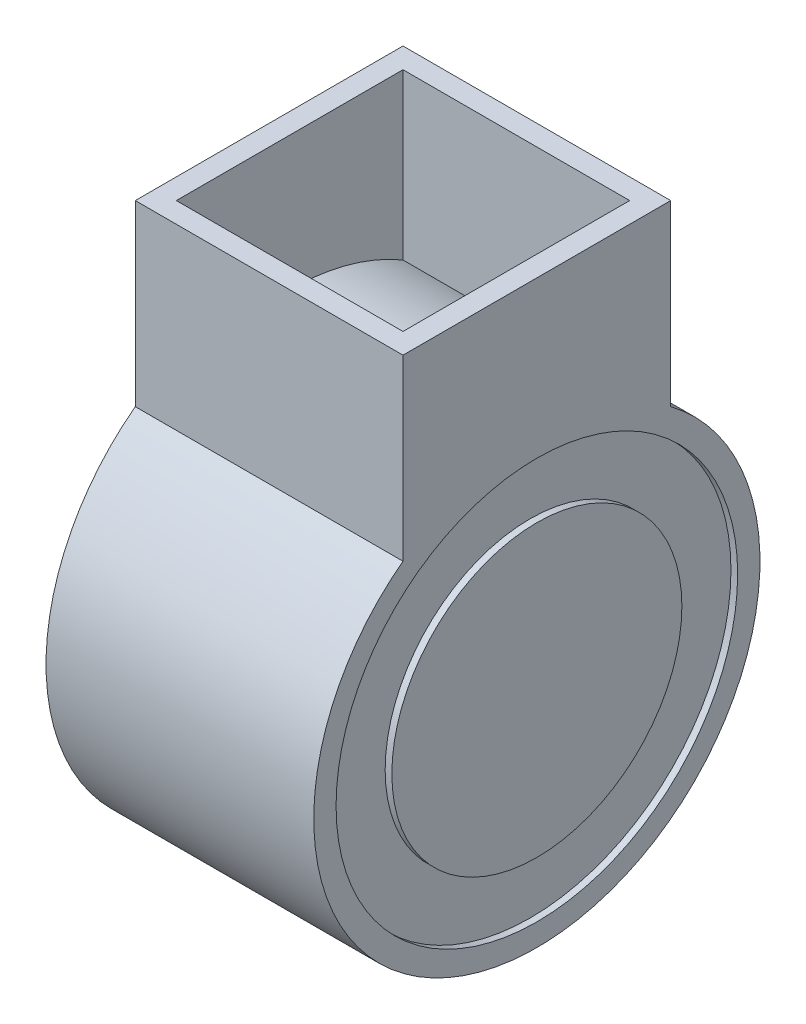
from build123d import *

# Parameters (mm, degrees)
CROQUIS1_R                   = 50
SALIENTE_EXTRUIR1_DEPTH      = 30
SALIENTE_EXTRUIR2_REACH      = 144.478
SALIENTE_EXTRUIR2_END_RADIUS = 50
CROQUIS3_W                   = 60
CROQUIS3_H                   = 60
CROQUIS3_W_2                 = 50.8
CROQUIS3_H_2                 = 50.8
CROQUIS4_R                   = 45
CROQUIS4_R_2                 = 32.5
CORTAR_EXTRUIR1_DEPTH        = 1.5


with BuildPart() as part:
    # Croquis1 → Saliente-Extruir1 (new, symmetric)
    with BuildSketch(Plane(origin=(0, 0, 0), x_dir=(0, 0, -1), z_dir=(1, 0, 0))):
        Circle(CROQUIS1_R)
    extrude(amount=SALIENTE_EXTRUIR1_DEPTH, both=True)

    # Saliente-Extruir2: up to this cylinder (the profile starts outside it)
    saliente_extruir2_end = Plane(origin=(0, 0, 0), z_dir=(-1, 0, 0)) * Cylinder(SALIENTE_EXTRUIR2_END_RADIUS, 389.956, mode=Mode.PRIVATE)
    # Croquis3 → Saliente-Extruir2 (add, up to the surface)
    with BuildSketch(Plane(origin=(0, 80, 0), x_dir=(1, 0, 0), z_dir=(0, 1, 0)), mode=Mode.PRIVATE) as saliente_extruir2_sk1:
        Rectangle(CROQUIS3_W, CROQUIS3_H)
        Rectangle(CROQUIS3_W_2, CROQUIS3_H_2, mode=Mode.SUBTRACT)
    saliente_extruir2_tool1 = extrude(saliente_extruir2_sk1.sketch, amount=-SALIENTE_EXTRUIR2_REACH, mode=Mode.PRIVATE) - saliente_extruir2_end
    add(saliente_extruir2_tool1.solids().sort_by_distance((0, 80, 29.151472))[0])

    # Croquis4 → Cortar-Extruir1 (cut)
    with BuildSketch(Plane(origin=(30, 0, 0), x_dir=(0, 0, -1), z_dir=(1, 0, 0))):
        Circle(CROQUIS4_R)
        Circle(CROQUIS4_R_2, mode=Mode.SUBTRACT)
    extrude(amount=-CORTAR_EXTRUIR1_DEPTH, mode=Mode.SUBTRACT)


solid = part.part
